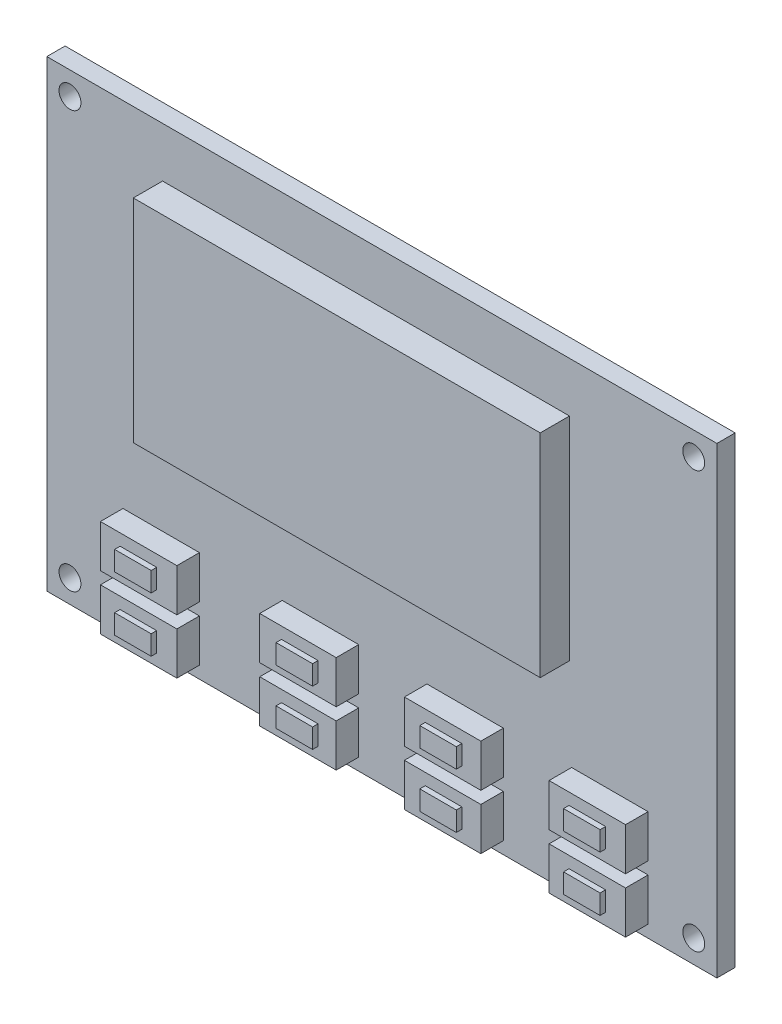
from build123d import *

# Parameters (mm, degrees)
SKETCH1_W           = 55
SKETCH1_H           = 38
SKETCH1_R           = 0.9
BOSS_EXTRUDE1_DEPTH = 0.75
SKETCH2_W           = 33.4
SKETCH2_H           = 17.4
BOSS_EXTRUDE2_DEPTH = 2.4
SKETCH4_W           = 6.275
SKETCH4_H           = 3.5
BOSS_EXTRUDE3_DEPTH = 1.85
SKETCH6_W           = 3
SKETCH6_H           = 1.6
BOSS_EXTRUDE4_DEPTH = 0.45


with BuildPart() as part:
    # Sketch1 → Boss-Extrude1 (new, symmetric)
    with BuildSketch(Plane.XY):
        Rectangle(SKETCH1_W, SKETCH1_H)
        with Locations((25.6, 17.1)):
            Circle(SKETCH1_R, mode=Mode.SUBTRACT)
        with Locations(Location((-25.6, 17.1, 0), (0, 0, 180))):
            Circle(SKETCH1_R, mode=Mode.SUBTRACT)
        with Locations(Location((25.6, -17.1, 0), (0, 0, 180))):
            Circle(SKETCH1_R, mode=Mode.SUBTRACT)
        with Locations((-25.6, -17.1)):
            Circle(SKETCH1_R, mode=Mode.SUBTRACT)
    extrude(amount=BOSS_EXTRUDE1_DEPTH, both=True)

    # Sketch2 → Boss-Extrude2 (add, symmetric)
    with BuildSketch(Plane.XY.offset(0.75)):
        with Locations((-1.3, 6.2)):
            Rectangle(SKETCH2_W, SKETCH2_H)
    extrude(amount=BOSS_EXTRUDE2_DEPTH, both=True)

    # Sketch4 → Boss-Extrude3 (add, symmetric)
    with BuildSketch(Plane.XY.offset(0.75)):
        with Locations((18.7125, -16.25)):
            Rectangle(SKETCH4_W, SKETCH4_H)
        with Locations((-18.1125, -16.25)):
            Rectangle(SKETCH4_W, SKETCH4_H)
        with Locations((6.8375, -16.25)):
            Rectangle(SKETCH4_W, SKETCH4_H)
        with Locations((-5.0375, -16.25)):
            Rectangle(SKETCH4_W, SKETCH4_H)
        with Locations((-18.1125, -11.75)):
            Rectangle(SKETCH4_W, SKETCH4_H)
        with Locations((-5.0375, -11.75)):
            Rectangle(SKETCH4_W, SKETCH4_H)
        with Locations((6.8375, -11.75)):
            Rectangle(SKETCH4_W, SKETCH4_H)
        with Locations((18.7125, -11.75)):
            Rectangle(SKETCH4_W, SKETCH4_H)
    extrude(amount=BOSS_EXTRUDE3_DEPTH, both=True)

    # Sketch6 → Boss-Extrude4 (add, symmetric)
    with BuildSketch(Plane.XY.offset(2.6)):
        with Locations((18.7125, -16.25)):
            Rectangle(SKETCH6_W, SKETCH6_H)
        with Locations((6.9125, -16.25)):
            Rectangle(SKETCH6_W, SKETCH6_H)
        with Locations((-4.8875, -16.25)):
            Rectangle(SKETCH6_W, SKETCH6_H)
        with Locations((6.9125, -11.75)):
            Rectangle(SKETCH6_W, SKETCH6_H)
        with Locations((-4.8875, -11.75)):
            Rectangle(SKETCH6_W, SKETCH6_H)
        with Locations((18.7125, -11.75)):
            Rectangle(SKETCH6_W, SKETCH6_H)
        with Locations((-18.1375, -16.25)):
            Rectangle(SKETCH6_W, SKETCH6_H)
        with Locations((-18.1375, -11.75)):
            Rectangle(SKETCH6_W, SKETCH6_H)
    extrude(amount=BOSS_EXTRUDE4_DEPTH, both=True)


solid = part.part
